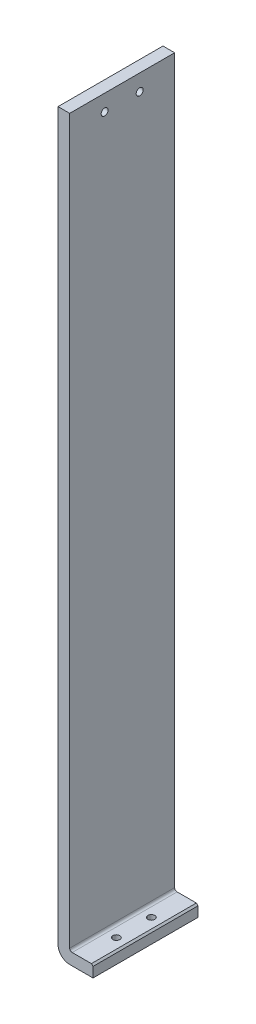
from build123d import *

# Parameters (mm, degrees)
BOSS_EXTRUDE1_DEPTH     = 45
CUT_EXTRUDE1_START      = -158.56066
SKETCH2_R               = 1.5
CUT_EXTRUDE1_DEPTH      = 10
CUT_EXTRUDE2_DEPTH      = 10
CUT_EXTRUDE2_DEPTH_BACK = 10
SKETCH3_R               = 1.5
CHAMFER1_SIZE           = 0.7


with BuildPart() as part:
    # Sketch1 → Boss-Extrude1 (new body)
    with BuildSketch(Plane.XY):
        with BuildLine():
            Line((2.5, -163.560660172), (12.5, -163.560660172))
            Line((12.5, -163.560660172), (12.5, -158.560660172))
            Line((12.5, -158.560660172), (3.560660172, -158.560660172))
            ThreePointArc((3.560660172, -158.560660172), (2.810660172, -158.25), (2.5, -157.5))
            Line((2.5, -157.5), (2.5, 152.5))
            Line((2.5, 152.5), (-2.5, 152.5))
            Line((-2.5, 152.5), (-2.5, -158.560660172))
            ThreePointArc((-2.5, -158.560660172), (-1.035533906, -162.096194078), (2.5, -163.560660172))
        make_face()
    extrude(amount=BOSS_EXTRUDE1_DEPTH)

    # Sketch2 → Cut-Extrude1 (cut)
    with BuildSketch(Plane(origin=(0, 0, 0), x_dir=(1, 0, 0), z_dir=(0, 1, 0)).offset(CUT_EXTRUDE1_START)):
        with Locations(Location((7.5, -15, 0), (0, 0, 270))):
            Circle(SKETCH2_R)
        with Locations(Location((7.5, -30, 0), (0, 0, 270))):
            Circle(SKETCH2_R)
    extrude(amount=-CUT_EXTRUDE1_DEPTH, mode=Mode.SUBTRACT)

    # Sketch3 → Cut-Extrude2 (cut, two sides: drawn at the far end of the back side and taken through both)
    with BuildSketch(Plane(origin=(0, 0, 0), x_dir=(0, 0, -1), z_dir=(1, 0, 0)).offset(-CUT_EXTRUDE2_DEPTH_BACK)):
        with Locations(Location((-15, 145.5, 0), (0, 0, 180))):
            Circle(SKETCH3_R)
        with Locations(Location((-30, 145.5, 0), (0, 0, 180))):
            Circle(SKETCH3_R)
    extrude(amount=CUT_EXTRUDE2_DEPTH + CUT_EXTRUDE2_DEPTH_BACK, mode=Mode.SUBTRACT)

    # Chamfer1
    chamfer1_edges = [part.edges().sort_by_distance(p)[0] for p in [
        (12.5, -158.560660172, 22.5),
    ]]
    chamfer(chamfer1_edges, length=CHAMFER1_SIZE)


solid = part.part
